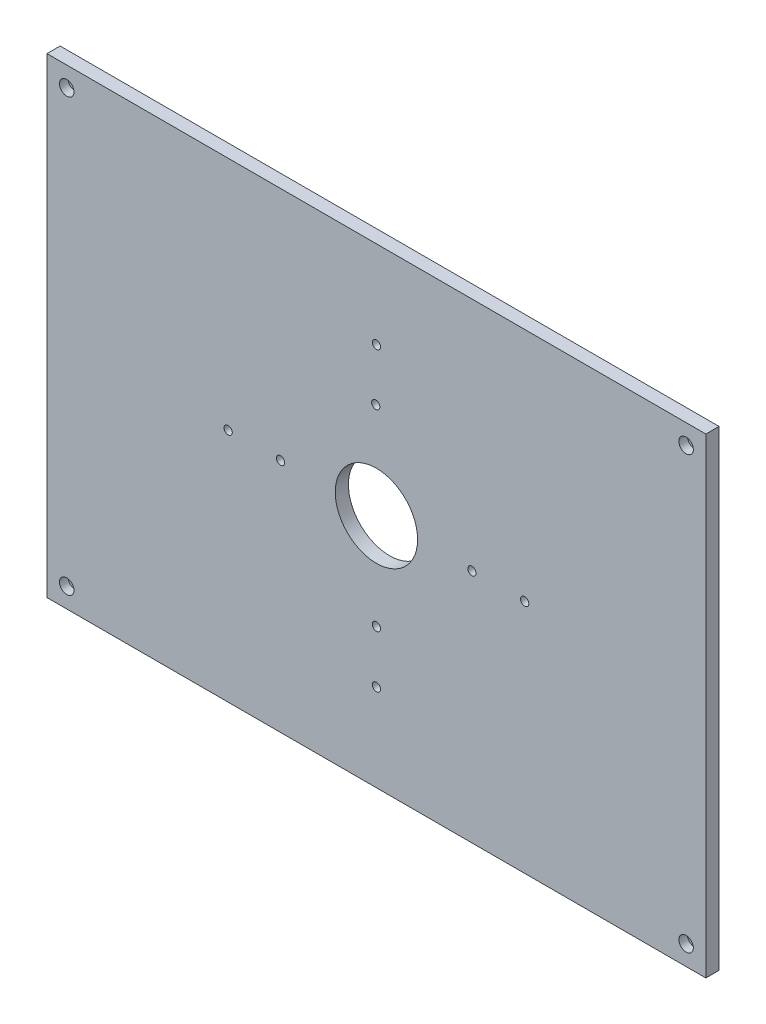
from build123d import *

# Parameters (mm, degrees)
SKETCH1_W           = 254
SKETCH1_H           = 181.61
BOSS_EXTRUDE1_DEPTH = 5.08
SKETCH2_R           = 15.875
CUT_EXTRUDE1_DEPTH  = 5.08
SKETCH3_R           = 1.5875
CUT_EXTRUDE3_DEPTH  = 7.62
SKETCH5_R           = 2.794
CUT_EXTRUDE5_DEPTH  = 3.302
SKETCH6_R           = 1.5875
CUT_EXTRUDE6_DEPTH  = 5.08


with BuildPart() as part:
    # Sketch1 → Boss-Extrude1 (new body)
    with BuildSketch(Plane.XY):
        with Locations((127, 90.805)):
            Rectangle(SKETCH1_W, SKETCH1_H)
    extrude(amount=BOSS_EXTRUDE1_DEPTH)

    # Sketch2 → Cut-Extrude1 (cut)
    with BuildSketch(Plane.XY.offset(5.08)):
        with Locations((127, 90.805)):
            Circle(SKETCH2_R)
    extrude(amount=-CUT_EXTRUDE1_DEPTH, mode=Mode.SUBTRACT)

    # Sketch3 → Cut-Extrude3 (cut)
    with BuildSketch(Plane.XY.offset(5.08)):
        with Locations((7.62, 173.99)):
            Circle(SKETCH3_R)
        with Locations((246.38, 173.99)):
            Circle(SKETCH3_R)
        with Locations((7.62, 7.62)):
            Circle(SKETCH3_R)
        with Locations((246.38, 7.62)):
            Circle(SKETCH3_R)
    extrude(amount=-CUT_EXTRUDE3_DEPTH, mode=Mode.SUBTRACT)

    # Sketch5 → Cut-Extrude5 (cut)
    with BuildSketch(Plane.XY.offset(5.08)):
        with Locations((246.38, 173.99)):
            Circle(SKETCH5_R)
        with Locations((246.38, 7.62)):
            Circle(SKETCH5_R)
        with Locations((7.62, 173.99)):
            Circle(SKETCH5_R)
        with Locations((7.62, 7.62)):
            Circle(SKETCH5_R)
    extrude(amount=-CUT_EXTRUDE5_DEPTH, mode=Mode.SUBTRACT)

    # Sketch6 → Cut-Extrude6 (cut)
    with BuildSketch(Plane.XY.offset(5.08)):
        with Locations((127, 147.955)):
            Circle(SKETCH6_R)
        with Locations((184.15, 90.805)):
            Circle(SKETCH6_R)
        with Locations((127, 33.655)):
            Circle(SKETCH6_R)
        with Locations((69.85, 90.805)):
            Circle(SKETCH6_R)
        with Locations((163.83, 90.805)):
            Circle(SKETCH6_R)
        with Locations((127, 53.848)):
            Circle(SKETCH6_R)
        with Locations((90.043, 90.805)):
            Circle(SKETCH6_R)
        with Locations((126.746, 127.761127137)):
            Circle(SKETCH6_R)
    extrude(amount=-CUT_EXTRUDE6_DEPTH, mode=Mode.SUBTRACT)


solid = part.part
